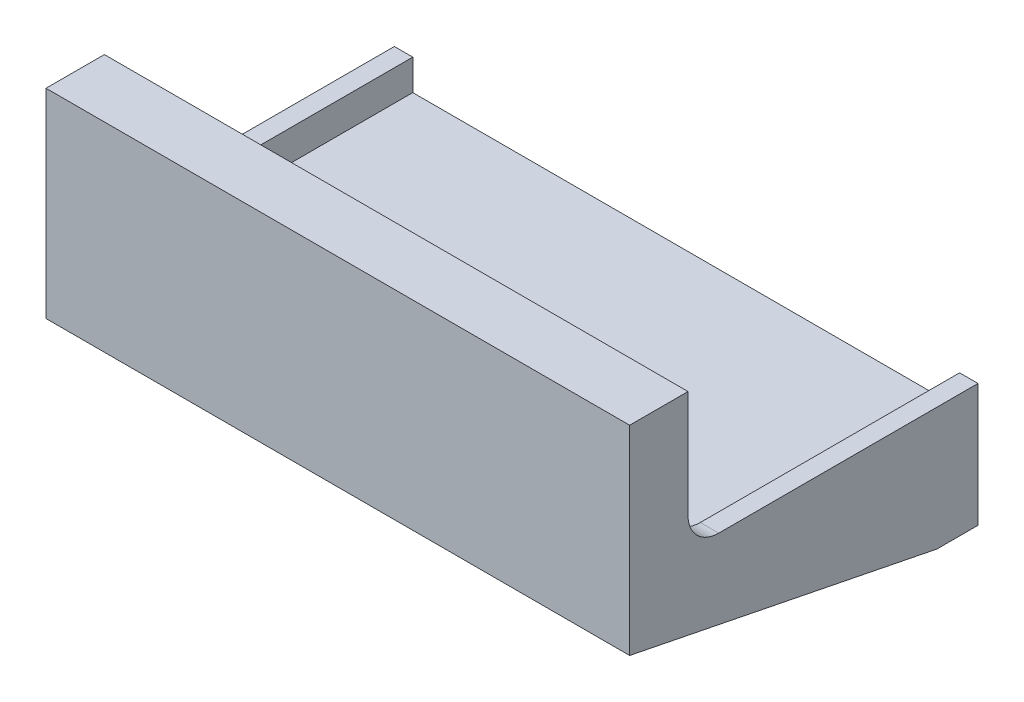
from build123d import *

# Parameters (mm, degrees)
BOSS_EXTRUDE1_DEPTH       = 53.2
SKETCH2_W                 = 95
SKETCH2_H                 = 20
BOSS_EXTRUDE2_DEPTH       = 3.5
CHAMFER1_SIZE             = 50
CHAMFER1_SIZE2            = 10
SKETCH3_W                 = 89
SKETCH3_H                 = 19
BOSS_EXTRUDE3_DEPTH       = 3.5
BOSS_EXTRUDE4_START       = -3.5
BOSS_EXTRUDE4_DEPTH       = 6
FILLET1_R                 = 5
F_2_5MM_DOWEL_HOLE1_D     = 3.2
F_2_5MM_DOWEL_HOLE1_DEPTH = 6.5
F_2_5MM_DOWEL_HOLE1_TIP   = 0.96137699


with BuildPart() as part:
    # Sketch1 → Boss-Extrude1 (new body)
    with BuildSketch(Plane.XY):
        Polygon((-60.5, 15), (-60.5, 20), (-57.5, 20), (-57.5, 0), (-152.5, 0), (-152.5, 20), (-149.5, 20), (-149.5, 15), align=None)
    extrude(amount=BOSS_EXTRUDE1_DEPTH)

    # Sketch2 → Boss-Extrude2 (add)
    with BuildSketch(Plane.XY.offset(53.2)):
        with Locations((-105, 10)):
            Rectangle(SKETCH2_W, SKETCH2_H)
    extrude(amount=BOSS_EXTRUDE2_DEPTH)

    # Chamfer1
    chamfer1_edges = [part.edges().sort_by_distance(p)[0] for p in [
        (-105, 0, 56.7),
    ]]
    chamfer1_side = [part.faces().sort_by_distance(p)[0] for p in [
        (-105, 0, 28.35),
    ]]
    chamfer(chamfer1_edges, length=CHAMFER1_SIZE, length2=CHAMFER1_SIZE2, reference=chamfer1_side[0])

    # Sketch3 → Boss-Extrude3 (add)
    with BuildSketch(Plane.XY.offset(56.7)):
        with Locations((-105, 29.5)):
            Rectangle(SKETCH3_W, SKETCH3_H)
        Polygon((-152.5, 42.463842296), (-152.5, 20), (-149.5, 20), (-149.5, 39), (-60.5, 39), (-60.5, 20), (-57.5, 20), (-57.5, 42.463842296), align=None)
    extrude(amount=-BOSS_EXTRUDE3_DEPTH)

    # Sketch3<3> → Boss-Extrude4 (add)
    with BuildSketch(Plane.XY.offset(56.7).offset(BOSS_EXTRUDE4_START)):
        Polygon((-152.5, 42.463842296), (-152.5, 20), (-149.5, 20), (-149.5, 39), (-60.5, 39), (-60.5, 20), (-57.5, 20), (-57.5, 42.463842296), align=None)
    extrude(amount=-BOSS_EXTRUDE4_DEPTH)

    # Fillet1
    fillet1_edges = [part.edges().sort_by_distance(p)[0] for p in [
        (-151, 20, 47.2),
        (-59, 20, 47.2),
    ]]
    fillet(fillet1_edges, radius=FILLET1_R)

    # Ø2.5mm Dowel Hole1
    with Locations(Plane(origin=(0, 0, 0), x_dir=(-1, 0, 0), z_dir=(0, 0, -1))):
        with Locations((70, 5.6), (140, 5.6)):
            Hole(F_2_5MM_DOWEL_HOLE1_D / 2, depth=F_2_5MM_DOWEL_HOLE1_DEPTH)
            with Locations((0, 0, -(F_2_5MM_DOWEL_HOLE1_DEPTH + F_2_5MM_DOWEL_HOLE1_TIP / 2))):  # 118° drill point
                Cone(0, F_2_5MM_DOWEL_HOLE1_D / 2, F_2_5MM_DOWEL_HOLE1_TIP, mode=Mode.SUBTRACT)


solid = part.part
